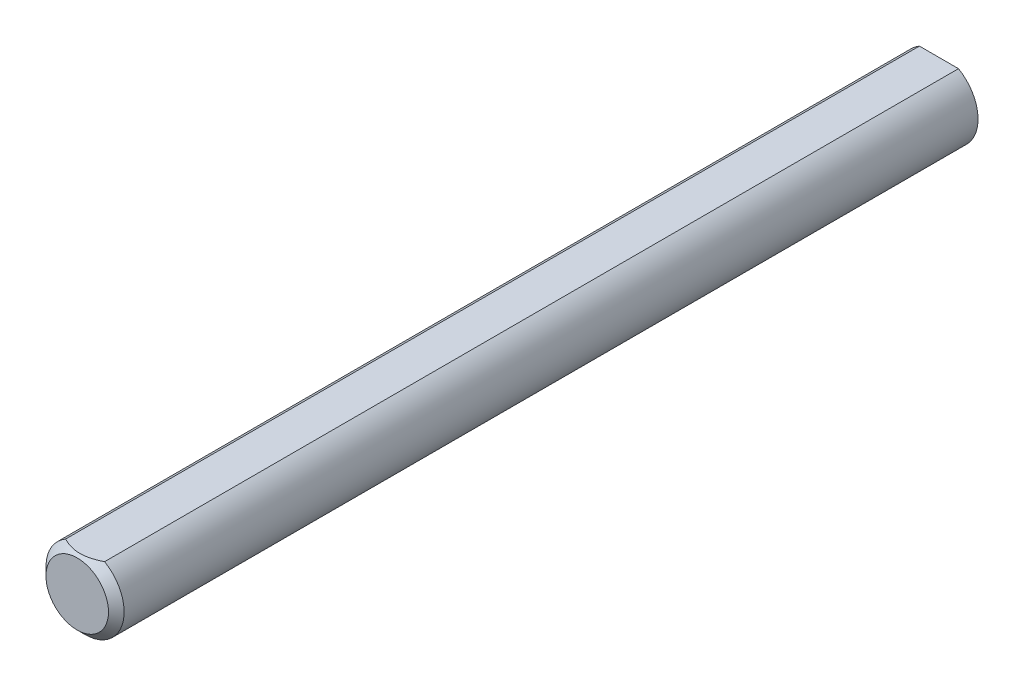
from build123d import *

# Parameters (mm, degrees)
SKETCH1_R           = 3.175
EXTRUDE1_DEPTH      = 76.2
CHAMFER1_SIZE       = 0.635
EXTRUDE7_DEPTH      = 77.332177029
EXTRUDE7_DEPTH_BACK = 77.332177029
CUT_EXTRUDE1_START  = -82.4
SKETCH14_R          = 3.175
CUT_EXTRUDE1_DEPTH  = 82.4


with BuildPart() as part:
    # Sketch1 → Extrude1 (new, symmetric)
    with BuildSketch(Plane.XY):
        with Locations(Location((0, 0, 0), (0, 0, 180))):
            Circle(SKETCH1_R)
    extrude(amount=EXTRUDE1_DEPTH, both=True)

    # Chamfer1
    chamfer1_edges = [part.edges().sort_by_distance(p)[0] for p in [
        (3.175, 0, -76.2),
        (3.175, 0, 76.2),
    ]]
    chamfer(chamfer1_edges, length=CHAMFER1_SIZE)

    # Sketch13 → Extrude7 (cut, two sides: drawn at the far end of the back side and taken through both)
    with BuildSketch(Plane.XY.offset(-EXTRUDE7_DEPTH_BACK)):
        with BuildLine():
            Line((-1.5875, 2.749630657), (1.5875, 2.749630657))
            ThreePointArc((1.5875, 2.749630657), (0, 3.175), (-1.5875, 2.749630657))
        make_face()
    extrude(amount=EXTRUDE7_DEPTH + EXTRUDE7_DEPTH_BACK, mode=Mode.SUBTRACT)

    # Sketch14 → Cut-Extrude1 (cut)
    with BuildSketch(Plane(origin=(0, 0, -76.2), x_dir=(-1, 0, 0), z_dir=(0, 0, -1)).offset(CUT_EXTRUDE1_START)):
        Circle(SKETCH14_R)
    extrude(amount=CUT_EXTRUDE1_DEPTH, mode=Mode.SUBTRACT)


solid = part.part
